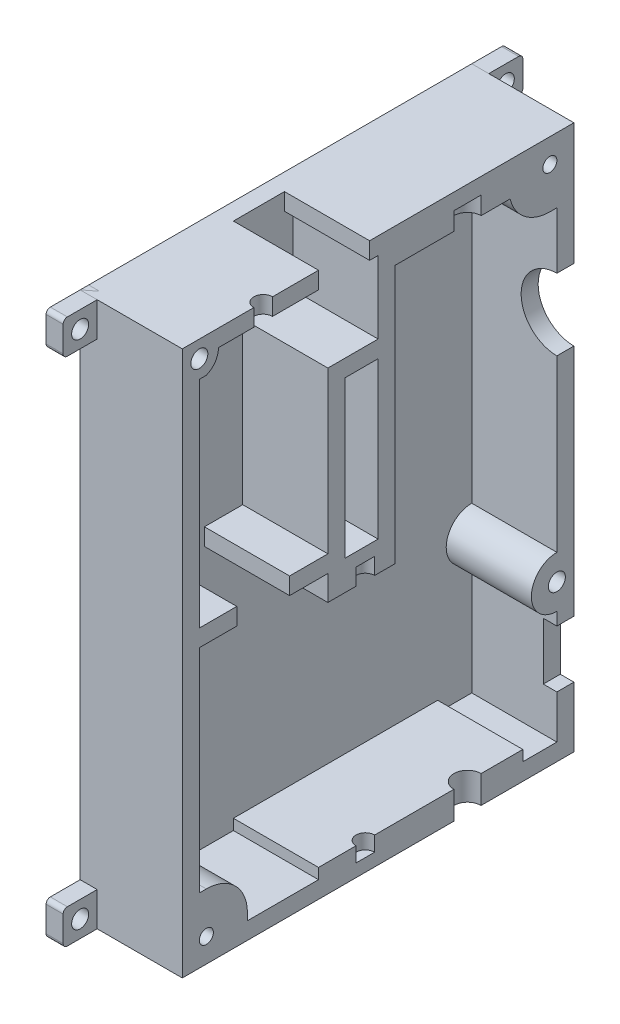
from build123d import *

# Parameters (mm, degrees)
SKETCH_1_W            = 46
SKETCH_1_H            = 64
EXTRUDE_1_DEPTH       = 12
SHELL_1_T             = -2
SKETCH_3_W            = 3.9
SKETCH_3_H            = 18.35
SKETCH_3_W_2          = 4.4
SKETCH_3_H_2          = 2
EXTRUDE_6_DEPTH       = 10
SKETCH_9_W            = 24
SKETCH_9_H            = 1.25
EXTRUDE_9_DEPTH       = 10
SKETCH_16_W           = 19
SKETCH_16_H           = 2
EXTRUDE_9_2_DEPTH     = 10
CUT_EXTRUDE_START     = -4
SKETCH_17_R           = 1.6
CUT_EXTRUDE_3_3_DEPTH = 2.1
CUT_EXTRUDE_1_REACH   = 71.058
SKETCH_4_R            = 1.1
SKETCH_4_W            = 10
SKETCH_4_H            = 6
CUT_EXTRUDE_3_2_REACH = 71.058
CUT_EXTRUDE_START_2   = -3.25
SKETCH_11_R           = 1.1
CUT_EXTRUDE_2_DEPTH   = 1.75
SKETCH_6_R            = 0.825
SKETCH_6_R_2          = 1
EXTRUDE_7_DEPTH       = 10
CUT_EXTRUDE_START_3   = -10
SKETCH_7_R            = 1
SKETCH_7_R_2          = 0.825
CUT_EXTRUDE_3_DEPTH   = 10
F_2MM_3_START         = -1.95
F_2MM_3_DEPTH         = 1.95
CUT_EXTRUDE_4_REACH   = 59.306
SKETCH_14_W           = 3.2
SKETCH_14_H           = 6.7
CUT_EXTRUDE_3_4_REACH = 59.306
SKETCH_19_R           = 4.2
SKETCH_20_W           = 5
SKETCH_20_H           = 4
SKETCH_20_R           = 1
EXTRUDE_10_DEPTH      = 2
EXTRUDE_10_2_DEPTH    = 2
EXTRUDE_10_3_DEPTH    = 2
EXTRUDE_10_4_DEPTH    = 2
FILLET_1_R            = 0.5
FILLET_2_R            = 0.5
FILLET_3_R            = 0.5
FILLET_4_R            = 0.5


with BuildPart() as part:
    # 草图1 → 凸台-拉伸1 (new body)
    with BuildSketch(Plane(origin=(0, 0, 0), x_dir=(0, 0, -1), z_dir=(1, 0, 0))):
        Rectangle(SKETCH_1_W, SKETCH_1_H)
    extrude(amount=EXTRUDE_1_DEPTH)

    # 抽壳1
    shell_1_openings = [part.faces().sort_by_distance(p)[0] for p in [
        (12, 0, 0),
    ]]
    offset(amount=SHELL_1_T, openings=shell_1_openings, kind=Kind.INTERSECTION)

    # 草图3 → 机位凸台-拉伸6 (add)
    # profile 1 of 2: a face of its own
    with BuildSketch(Plane(origin=(2, 0, 0), x_dir=(0, 0, -1), z_dir=(1, 0, 0))):
        Polygon((-5.9, 21.5), (0, 21.5), (0, 30), (2, 30), (2, 17.175), (2, -2.35), (-5.9, -2.35), (-5.9, 0.6), (-10.4, 0.6), (-10.4, 2.6), (-5.9, 2.6), align=None)
        with Locations((-1.95, 10.325)):
            Rectangle(SKETCH_3_W, SKETCH_3_H, mode=Mode.SUBTRACT)
    # profile 2 of 2: a face of its own
    with BuildSketch(Plane(origin=(2, 0, 0), x_dir=(0, 0, -1), z_dir=(1, 0, 0))):
        with Locations((-18.8, 1.6)):
            Rectangle(SKETCH_3_W_2, SKETCH_3_H_2)
    extrude(amount=EXTRUDE_6_DEPTH)

    # 草图9 → Extrude 9 (add)
    with BuildSketch(Plane(origin=(2, 0, 0), x_dir=(0, 0, -1), z_dir=(1, 0, 0))):
        with Locations((5, -29.375)):
            Rectangle(SKETCH_9_W, SKETCH_9_H)
    extrude(amount=EXTRUDE_9_DEPTH)

    # 草图16 → Extrude 9 2 (add)
    with BuildSketch(Plane(origin=(2, 0, 0), x_dir=(0, 0, -1), z_dir=(1, 0, 0))):
        with Locations((11.5, 29)):
            Rectangle(SKETCH_16_W, SKETCH_16_H)
    extrude(amount=EXTRUDE_9_2_DEPTH)

    # 草图17 → 后部孔位3切除-拉伸3 (cut)
    with BuildSketch(Plane(origin=(0, 32, 0), x_dir=(1, 0, 0), z_dir=(0, 1, 0)).offset(CUT_EXTRUDE_START)):
        with Locations((12, 10.5)):
            Circle(SKETCH_17_R)
    extrude(amount=CUT_EXTRUDE_3_3_DEPTH, mode=Mode.SUBTRACT)

    # 草图4 → 后部孔位切除-拉伸1 (cut, up to next)
    with BuildSketch(Plane(origin=(0, 32, 0), x_dir=(1, 0, 0), z_dir=(0, 1, 0)), mode=Mode.PRIVATE) as cut_extrude_1_sk1:
        with Locations((12, -13.5)):
            Circle(SKETCH_4_R)
    cut_extrude_1_tool1 = extrude(cut_extrude_1_sk1.sketch, amount=-CUT_EXTRUDE_1_REACH, mode=Mode.PRIVATE) & part.part
    # 草图4 → 后部孔位切除-拉伸1 (cut, up to next)
    with BuildSketch(Plane(origin=(0, 32, 0), x_dir=(1, 0, 0), z_dir=(0, 1, 0)), mode=Mode.PRIVATE) as cut_extrude_1_sk2:
        with Locations((7, -4)):
            Rectangle(SKETCH_4_W, SKETCH_4_H)
    cut_extrude_1_tool2 = extrude(cut_extrude_1_sk2.sketch, amount=-CUT_EXTRUDE_1_REACH, mode=Mode.PRIVATE) & part.part
    add(cut_extrude_1_tool1.solids().sort_by_distance((12, 32, 13.5))[0], mode=Mode.SUBTRACT)
    add(cut_extrude_1_tool2.solids().sort_by_distance((7, 32, 4))[0], mode=Mode.SUBTRACT)

    # 草图5 → 前部切除3-拉伸2 (cut, up to next)
    with BuildSketch(Plane.XZ.offset(32), mode=Mode.PRIVATE) as cut_extrude_3_2_sk1:
        with BuildLine():
            Line((12, -12.1), (12, -8.9))
            ThreePointArc((12, -8.9), (10.4, -10.5), (12, -12.1))
        make_face()
    cut_extrude_3_2_tool1 = extrude(cut_extrude_3_2_sk1.sketch, amount=-CUT_EXTRUDE_3_2_REACH, mode=Mode.PRIVATE) & part.part
    add(cut_extrude_3_2_tool1.solids().sort_by_distance((11.320939, -32, -10.5))[0], mode=Mode.SUBTRACT)

    # 草图11 → 切除-拉伸2 (cut)
    with BuildSketch(Plane.XZ.offset(32).offset(CUT_EXTRUDE_START_2)):
        with Locations((12, 1.5)):
            Circle(SKETCH_11_R)
    extrude(amount=CUT_EXTRUDE_2_DEPTH, mode=Mode.SUBTRACT)

    # 草图6 → 螺丝孔凸台-拉伸7 (add)
    # profile 1 of 4: a face of its own
    with BuildSketch(Plane(origin=(2, 0, 0), x_dir=(0, 0, -1), z_dir=(1, 0, 0))):
        with BuildLine():
            Line((-20.175, -24.35), (-23, -24.35))
            Line((-23, -24.35), (-23, -32))
            Line((-23, -32), (-15.35, -32))
            Line((-15.35, -32), (-15.35, -29.175))
            ThreePointArc((-15.35, -29.175), (-16.763209781, -25.763209781), (-20.175, -24.35))
        make_face()
        with Locations((-20.175, -29.175)):
            Circle(SKETCH_6_R, mode=Mode.SUBTRACT)
    # profile 2 of 4: a face of its own
    with BuildSketch(Plane(origin=(2, 0, 0), x_dir=(0, 0, -1), z_dir=(1, 0, 0))):
        with BuildLine():
            Line((-23, 28.969223594), (-23, 31.030776406))
            ThreePointArc((-23, 31.030776406), (-22.590990258, 31.590990258), (-22.030776406, 32))
            Line((-22.030776406, 32), (-19.969223594, 32))
            ThreePointArc((-19.969223594, 32), (-18.75332077, 29.877801645), (-20.192225279, 27.9))
            Line((-20.192225279, 27.9), (-23, 27.9))
            Line((-23, 27.9), (-23, 28.969223594))
        make_face()
        with Locations((-21, 30)):
            Circle(SKETCH_6_R_2, mode=Mode.SUBTRACT)
    # profile 3 of 4: a face of its own
    with BuildSketch(Plane(origin=(2, 0, 0), x_dir=(0, 0, -1), z_dir=(1, 0, 0))):
        with BuildLine():
            Line((15.35, 32), (23, 32))
            Line((23, 32), (23, 24.35))
            Line((23, 24.35), (20.175, 24.35))
            ThreePointArc((20.175, 24.35), (16.763209781, 25.763209781), (15.35, 29.175))
            Line((15.35, 29.175), (15.35, 32))
        make_face()
        with Locations((20.175, 29.175)):
            Circle(SKETCH_6_R, mode=Mode.SUBTRACT)
    # profile 4 of 4: a face of its own
    with BuildSketch(Plane(origin=(2, 0, 0), x_dir=(0, 0, -1), z_dir=(1, 0, 0))):
        with BuildLine():
            Line((23, -11.463932023), (23, -15.936067977))
            ThreePointArc((23, -15.936067977), (18, -13.7), (23, -11.463932023))
        make_face()
        with Locations((21, -13.7)):
            Circle(SKETCH_6_R_2, mode=Mode.SUBTRACT)
    extrude(amount=EXTRUDE_7_DEPTH)

    # 草图7 → Cut-Extrude 3 (cut)
    with BuildSketch(Plane(origin=(12, 0, 0), x_dir=(0, 0, -1), z_dir=(1, 0, 0)).offset(CUT_EXTRUDE_START_3)):
        with Locations((21, -13.7)):
            Circle(SKETCH_7_R)
        with Locations((-21, 30)):
            Circle(SKETCH_7_R)
        with Locations((20.175, 29.175)):
            Circle(SKETCH_7_R_2)
    extrude(amount=CUT_EXTRUDE_3_DEPTH, mode=Mode.SUBTRACT)

    # 草图12 → 2mm切孔切除-拉伸3 (cut)
    with BuildSketch(Plane.XZ.offset(2.35).offset(F_2MM_3_START)):
        with BuildLine():
            Line((12, 2.6), (12, 0.4))
            ThreePointArc((12, 0.4), (10.9, 1.5), (12, 2.6))
        make_face()
    extrude(amount=F_2MM_3_DEPTH, mode=Mode.SUBTRACT)

    # 草图14 → 拨杆切除-拉伸4 (cut, up to next)
    with BuildSketch(Plane(origin=(0, 0, -23), x_dir=(-1, 0, 0), z_dir=(0, 0, -1)), mode=Mode.PRIVATE) as cut_extrude_4_sk1:
        with Locations((-12, -21.55)):
            Rectangle(SKETCH_14_W, SKETCH_14_H)
    cut_extrude_4_tool1 = extrude(cut_extrude_4_sk1.sketch, amount=-CUT_EXTRUDE_4_REACH, mode=Mode.PRIVATE) & part.part
    add(cut_extrude_4_tool1.solids().sort_by_distance((12, -21.55, -23))[0], mode=Mode.SUBTRACT)

    # 草图19 → Cut-Extrude 3 4 (cut, up to next)
    with BuildSketch(Plane(origin=(0, 0, -23), x_dir=(-1, 0, 0), z_dir=(0, 0, -1)), mode=Mode.PRIVATE) as cut_extrude_3_4_sk1:
        with Locations((-12, 13.49)):
            Circle(SKETCH_19_R)
    cut_extrude_3_4_tool1 = extrude(cut_extrude_3_4_sk1.sketch, amount=-CUT_EXTRUDE_3_4_REACH, mode=Mode.PRIVATE) & part.part
    add(cut_extrude_3_4_tool1.solids().sort_by_distance((12, 13.49, -23))[0], mode=Mode.SUBTRACT)


with BuildPart() as body_2:
    # 草图20 → 固定位凸台-拉伸10 (new body)
    with BuildSketch(Plane.ZY):
        with Locations((-24.5, 30)):
            Rectangle(SKETCH_20_W, SKETCH_20_H)
        with Locations((-25, 30)):
            Circle(SKETCH_20_R, mode=Mode.SUBTRACT)
    extrude(amount=-EXTRUDE_10_DEPTH)

    # 圆角4
    fillet_4_edges = [body_2.edges().sort_by_distance(p)[0] for p in [
        (1, 28, -27),
        (1, 32, -27),
    ]]
    fillet(fillet_4_edges, radius=FILLET_4_R)


with BuildPart() as body_3:
    # 草图20 → Extrude 10 2 (new body)
    with BuildSketch(Plane.ZY):
        with Locations((24.5, 30)):
            Rectangle(SKETCH_20_W, SKETCH_20_H)
        with Locations(Location((25, 30, 0), (0, 0, 180))):
            Circle(SKETCH_20_R, mode=Mode.SUBTRACT)
    extrude(amount=-EXTRUDE_10_2_DEPTH)

    # 圆角3
    fillet_3_edges = [body_3.edges().sort_by_distance(p)[0] for p in [
        (1, 32, 27),
        (1, 28, 27),
    ]]
    fillet(fillet_3_edges, radius=FILLET_3_R)


with BuildPart() as body_4:
    # 草图20 → Extrude 10 3 (new body)
    with BuildSketch(Plane.ZY):
        with Locations((24.5, -30)):
            Rectangle(SKETCH_20_W, SKETCH_20_H)
        with Locations((25, -30)):
            Circle(SKETCH_20_R, mode=Mode.SUBTRACT)
    extrude(amount=-EXTRUDE_10_3_DEPTH)

    # 圆角2
    fillet_2_edges = [body_4.edges().sort_by_distance(p)[0] for p in [
        (1, -28, 27),
        (1, -32, 27),
    ]]
    fillet(fillet_2_edges, radius=FILLET_2_R)


with BuildPart() as body_5:
    # 草图20 → Extrude 10 4 (new body)
    with BuildSketch(Plane.ZY):
        with Locations((-24.5, -30)):
            Rectangle(SKETCH_20_W, SKETCH_20_H)
        with Locations(Location((-25, -30, 0), (0, 0, 180))):
            Circle(SKETCH_20_R, mode=Mode.SUBTRACT)
    extrude(amount=-EXTRUDE_10_4_DEPTH)

    # 圆角1
    fillet_1_edges = [body_5.edges().sort_by_distance(p)[0] for p in [
        (1, -32, -27),
        (1, -28, -27),
    ]]
    fillet(fillet_1_edges, radius=FILLET_1_R)


solid = Compound([part.part, body_2.part, body_3.part, body_4.part, body_5.part])
